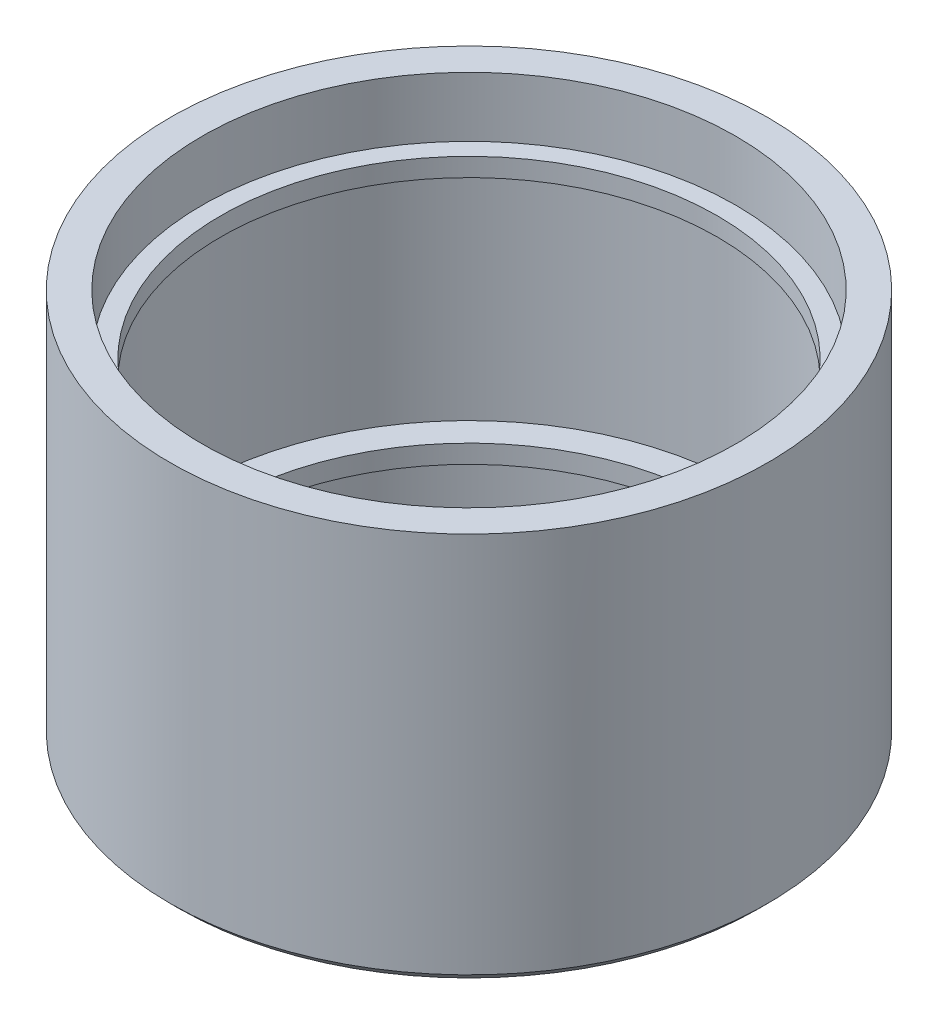
from build123d import *

# Parameters (mm, degrees)
CHAMFER1_SIZE = 1


with BuildPart() as part:
    # Sketch3 → Revolve2 (revolve)
    with BuildSketch(Plane(origin=(0, 0, 0), x_dir=(0, 0, -1), z_dir=(1, 0, 0)), mode=Mode.PRIVATE) as revolve2_sk:
        Polygon((-29, -21.25), (-29, -14.25), (-27, -14.25), (-27, -12.25), (-30, -12.25), (-30, 12.75), (-27, 12.75), (-27, 14.75), (-29, 14.75), (-29, 21.25), (-32.5, 21.25), (-32.5, -21.25), align=None)
    revolve(revolve2_sk.sketch.rotate(Axis((0, -21.25, 0), (0, 1, 0)), 180), axis=Axis((0, -21.25, 0), (0, 1, 0)))

    # Chamfer1
    chamfer1_edges = [part.edges().sort_by_distance(p)[0] for p in [
        (0, -21.25, 32.5),
    ]]
    chamfer(chamfer1_edges, length=CHAMFER1_SIZE)


solid = part.part
